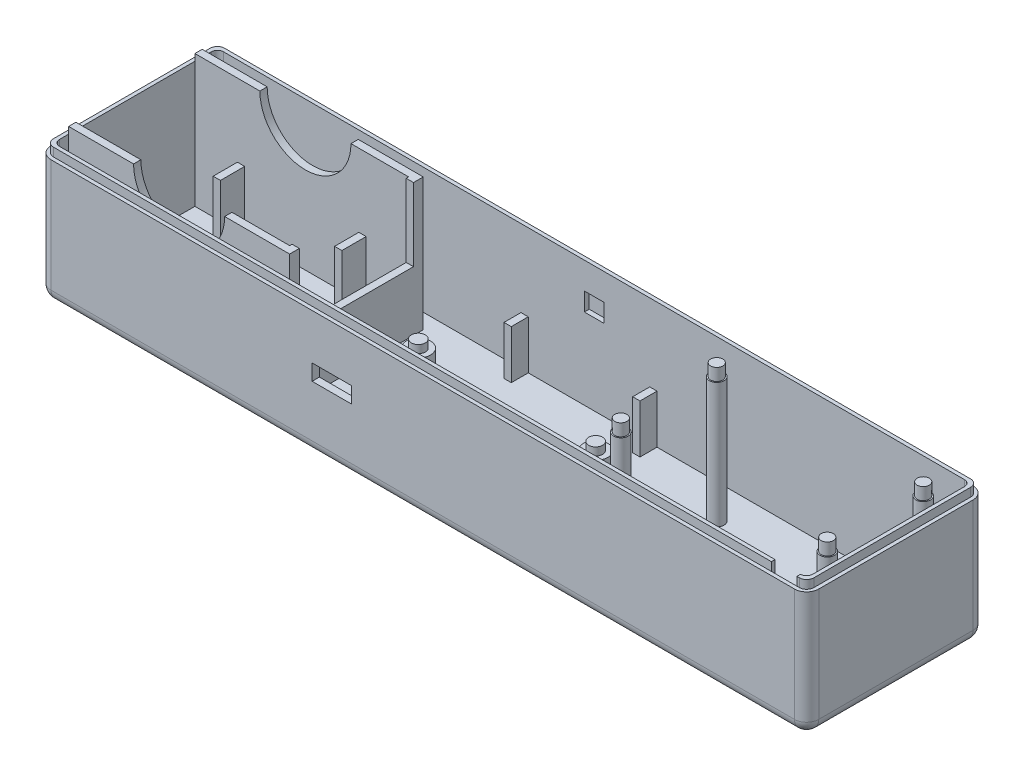
from build123d import *

# Parameters (mm, degrees)
SKETCH1_W            = 160.5788
SKETCH1_H            = 37.338
BOSS_EXTRUDE1_DEPTH  = 27.94
SKETCH2_W            = 157.5308
SKETCH2_H            = 34.29
CUT_EXTRUDE3_DEPTH   = 26.289
FILLET1_R            = 2.54
FILLET2_R            = 1.27
SKETCH3_W            = 46.228
SKETCH3_H            = 27.94
BOSS_EXTRUDE2_DEPTH  = 27.686
SKETCH8_W            = 44.704
SKETCH8_H            = 24.892
CUT_EXTRUDE6_DEPTH   = 27.686
CUT_EXTRUDE5_REACH   = 93.501
SKETCH7_R            = 9.525
CUT_EXTRUDE7_REACH   = 121.521
SKETCH9_W            = 23.876
SKETCH9_H            = 15.24
SKETCH10_R           = 2.54
SKETCH10_W           = 1.524
SKETCH10_H           = 3.556
BOSS_EXTRUDE5_DEPTH  = 10.16
SKETCH11_R           = 1.4605
BOSS_EXTRUDE6_DEPTH  = 1.651
CUT_EXTRUDE8_REACH   = 95.28
SKETCH12_W           = 8.218436834
SKETCH12_H           = 3.333271446
SKETCH13_R           = 1.524
BOSS_EXTRUDE7_DEPTH  = 26.162
SKETCH14_R           = 1.27
BOSS_EXTRUDE8_DEPTH  = 2.54
SKETCH15_W           = 1.524
SKETCH15_H           = 5.08
BOSS_EXTRUDE9_DEPTH  = 12.446
SKETCH16_OUTSIDE_W   = 196.104
SKETCH16_OUTSIDE_H   = 72.864
SKETCH16_OUTSIDE_W_2 = 159.0548
SKETCH16_OUTSIDE_H_2 = 35.814
CUT_EXTRUDE9_DEPTH   = 1.778
FILLET3_R            = 1.524
SKETCH17_W           = 5.334
SKETCH17_H           = 0.762
CUT_EXTRUDE10_DEPTH  = 8.89
SKETCH18_W           = 4.064
SKETCH18_H           = 3.81
CUT_EXTRUDE11_DEPTH  = 1.016
SKETCH19_W           = 0.284935898
SKETCH19_H           = 3.175
MAGNET_TEXT_DEPTH    = 0.1778


with BuildPart() as part:
    # Sketch1 → Boss-Extrude1 (new body)
    with BuildSketch(Plane(origin=(0, 0, 0), x_dir=(1, 0, 0), z_dir=(0, 1, 0))):
        Rectangle(SKETCH1_W, SKETCH1_H)
    extrude(amount=BOSS_EXTRUDE1_DEPTH)

    # Sketch2 → Cut-Extrude3 (cut)
    with BuildSketch(Plane(origin=(0, 27.94, 0), x_dir=(1, 0, 0), z_dir=(0, 1, 0))):
        Rectangle(SKETCH2_W, SKETCH2_H)
    extrude(amount=-CUT_EXTRUDE3_DEPTH, mode=Mode.SUBTRACT)

    # Fillet1
    fillet1_edges = [part.edges().sort_by_distance(p)[0] for p in [
        (0, 0, 18.669),
        (-80.2894, 0, 0),
        (0, 0, -18.669),
        (80.2894, 0, 0),
        (80.2894, 13.97, 18.669),
        (-80.2894, 13.97, 18.669),
        (-80.2894, 13.97, -18.669),
        (80.2894, 13.97, -18.669),
    ]]
    fillet(fillet1_edges, radius=FILLET1_R)

    # Fillet2
    fillet2_edges = [part.edges().sort_by_distance(p)[0] for p in [
        (-78.7654, 14.7955, -17.145),
        (-78.7654, 14.7955, 17.145),
        (78.7654, 14.7955, 17.145),
        (78.7654, 14.7955, -17.145),
    ]]
    fillet(fillet2_edges, radius=FILLET2_R)

    # Sketch3 → Boss-Extrude2 (add)
    with BuildSketch(Plane(origin=(0, 1.651, 0), x_dir=(1, 0, 0), z_dir=(0, 1, 0))):
        with Locations((-55.6514, 0)):
            Rectangle(SKETCH3_W, SKETCH3_H)
    extrude(amount=BOSS_EXTRUDE2_DEPTH)

    # Sketch8 → Cut-Extrude6 (cut)
    with BuildSketch(Plane(origin=(0, 29.337, 0), x_dir=(1, 0, 0), z_dir=(0, 1, 0))):
        with Locations((-56.4134, 0)):
            Rectangle(SKETCH8_W, SKETCH8_H)
    extrude(amount=-CUT_EXTRUDE6_DEPTH, mode=Mode.SUBTRACT)

    # Cut-Extrude5: up to this face of the body (flat: up to its plane)
    cut_extrude5_end = Plane(part.part.faces().sort_by_distance((-55.6514, 15.494, -13.97))[0])
    # Sketch7 → Cut-Extrude5 (cut, up to the picked face)
    with BuildSketch(Plane.XY.offset(13.97), mode=Mode.PRIVATE) as cut_extrude5_sk1:
        with Locations((-55.6514, 29.337)):
            Circle(SKETCH7_R)
    cut_extrude5_tool1 = split(extrude(cut_extrude5_sk1.sketch, amount=-CUT_EXTRUDE5_REACH, mode=Mode.PRIVATE), bisect_by=cut_extrude5_end, keep=Keep.BOTH, mode=Mode.PRIVATE)
    add(cut_extrude5_tool1.solids().sort_by(Axis((-55.6514, 29.337, 13.97), (0, 0, -1)))[0], mode=Mode.SUBTRACT)

    # Sketch9 → Cut-Extrude7 (cut, up to next)
    with BuildSketch(Plane.ZY.offset(34.0614), mode=Mode.PRIVATE) as cut_extrude7_sk1:
        with Locations((0, 21.717)):
            Rectangle(SKETCH9_W, SKETCH9_H)
    cut_extrude7_tool1 = extrude(cut_extrude7_sk1.sketch, amount=-CUT_EXTRUDE7_REACH, mode=Mode.PRIVATE) & part.part
    add(cut_extrude7_tool1.solids().sort_by_distance((-34.0614, 21.717, 0))[0], mode=Mode.SUBTRACT)

    # Sketch10 → Boss-Extrude5 (add)
    with BuildSketch(Plane(origin=(0, 1.651, 0), x_dir=(1, 0, 0), z_dir=(0, 1, 0))):
        with Locations(Location((-19.5834, 0, 0), (0, 0, 90))):
            Circle(SKETCH10_R)
        with Locations(Location((17.5006, 0, 0), (0, 0, 90))):
            Circle(SKETCH10_R)
        with Locations((-14.5034, 15.367)):
            Rectangle(SKETCH10_W, SKETCH10_H)
        with Locations((12.4206, 15.367)):
            Rectangle(SKETCH10_W, SKETCH10_H)
        with Locations((-14.5034, -15.367)):
            Rectangle(SKETCH10_W, SKETCH10_H)
        with Locations((12.4206, -15.367)):
            Rectangle(SKETCH10_W, SKETCH10_H)
    extrude(amount=BOSS_EXTRUDE5_DEPTH)

    # Sketch11 → Boss-Extrude6 (add)
    with BuildSketch(Plane(origin=(0, 11.811, 0), x_dir=(1, 0, 0), z_dir=(0, 1, 0))):
        with Locations(Location((17.5006, 0, 0), (0, 0, 90))):
            Circle(SKETCH11_R)
        with Locations(Location((-19.5834, 0, 0), (0, 0, 90))):
            Circle(SKETCH11_R)
    extrude(amount=BOSS_EXTRUDE6_DEPTH)

    # Sketch12 → Cut-Extrude8 (cut, up to next)
    with BuildSketch(Plane.XY.offset(18.669), mode=Mode.PRIVATE) as cut_extrude8_sk1:
        with Locations((-19.030181583, 15.001635723)):
            Rectangle(SKETCH12_W, SKETCH12_H)
    cut_extrude8_tool1 = extrude(cut_extrude8_sk1.sketch, amount=-CUT_EXTRUDE8_REACH, mode=Mode.PRIVATE) & part.part
    add(cut_extrude8_tool1.solids().sort_by_distance((-19.030182, 15.001636, 18.669))[0], mode=Mode.SUBTRACT)

    # Sketch13 → Boss-Extrude7 (add)
    with BuildSketch(Plane(origin=(0, 1.651, 0), x_dir=(1, 0, 0), z_dir=(0, 1, 0))):
        with Locations(Location((32.7914, 10.033, 0), (0, 0, 90))):
            Circle(SKETCH13_R)
        with Locations(Location((75.9714, 10.033, 0), (0, 0, 90))):
            Circle(SKETCH13_R)
        with Locations(Location((75.9714, -10.033, 0), (0, 0, 90))):
            Circle(SKETCH13_R)
        with Locations(Location((32.7914, -10.033, 0), (0, 0, 90))):
            Circle(SKETCH13_R)
    extrude(amount=BOSS_EXTRUDE7_DEPTH)

    # Sketch14 → Boss-Extrude8 (add)
    with BuildSketch(Plane(origin=(0, 27.813, 0), x_dir=(1, 0, 0), z_dir=(0, 1, 0))):
        with Locations(Location((32.7914, 10.033, 0), (0, 0, 270))):
            Circle(SKETCH14_R)
        with Locations(Location((32.7914, -10.033, 0), (0, 0, 270))):
            Circle(SKETCH14_R)
        with Locations(Location((75.9714, -10.033, 0), (0, 0, 270))):
            Circle(SKETCH14_R)
        with Locations(Location((75.9714, 10.033, 0), (0, 0, 270))):
            Circle(SKETCH14_R)
    extrude(amount=BOSS_EXTRUDE8_DEPTH)

    # Sketch15 → Boss-Extrude9 (add)
    with BuildSketch(Plane(origin=(0, 1.651, 0), x_dir=(1, 0, 0), z_dir=(0, 1, 0))):
        with Locations((-43.7134, 9.906)):
            Rectangle(SKETCH15_W, SKETCH15_H)
        with Locations((-43.7134, -9.906)):
            Rectangle(SKETCH15_W, SKETCH15_H)
        with Locations((-69.1134, 9.906)):
            Rectangle(SKETCH15_W, SKETCH15_H)
        with Locations((-69.1134, -9.906)):
            Rectangle(SKETCH15_W, SKETCH15_H)
    extrude(amount=BOSS_EXTRUDE9_DEPTH)

    # Sketch16 outside → Cut-Extrude9 (cut)
    with BuildSketch(Plane(origin=(0, 27.94, 0), x_dir=(1, 0, 0), z_dir=(0, 1, 0))):
        Rectangle(SKETCH16_OUTSIDE_W, SKETCH16_OUTSIDE_H)
        Rectangle(SKETCH16_OUTSIDE_W_2, SKETCH16_OUTSIDE_H_2, mode=Mode.SUBTRACT)
    extrude(amount=-CUT_EXTRUDE9_DEPTH, mode=Mode.SUBTRACT)

    # Fillet3
    fillet3_edges = [part.edges().sort_by_distance(p)[0] for p in [
        (-79.5274, 27.051, -17.907),
        (79.5274, 27.051, -17.907),
        (79.5274, 27.051, 17.907),
        (-79.5274, 27.051, 17.907),
    ]]
    fillet(fillet3_edges, radius=FILLET3_R)

    # Sketch17 → Cut-Extrude10 (cut)
    with BuildSketch(Plane(origin=(0, 27.94, 0), x_dir=(1, 0, 0), z_dir=(0, 1, 0))):
        with Locations((74.8284, -17.526)):
            Rectangle(SKETCH17_W, SKETCH17_H)
    extrude(amount=-CUT_EXTRUDE10_DEPTH, mode=Mode.SUBTRACT)

    # Sketch18 → Cut-Extrude11 (cut)
    with BuildSketch(Plane(origin=(0, 0, 17.145), x_dir=(-1, 0, 0), z_dir=(0, 0, -1))):
        with Locations((-0.0254, 20.447)):
            Rectangle(SKETCH18_W, SKETCH18_H)
    cut_extrude11 = extrude(amount=-CUT_EXTRUDE11_DEPTH, mode=Mode.SUBTRACT)

    # Mirror1: Cut-Extrude11 across plane
    add(cut_extrude11.mirror(Plane.XY), mode=Mode.SUBTRACT)

    # Sketch19 → Magnet Text (cut)
    # profile 1 of 16: a face of its own
    with BuildSketch(Plane(origin=(0, 0, -18.669), x_dir=(-1, 0, 0), z_dir=(0, 0, -1))):
        Polygon((-14.778698451, 19.911562535), (-14.778698451, 20.237203561), (-13.109788194, 20.237203561), (-13.109788194, 19.911562535), (-13.801775374, 19.911562535), (-13.801775374, 17.062203561), (-14.086711271, 17.062203561), (-14.086711271, 19.911562535), align=None)
    # profile 2 of 16: a face of its own
    with BuildSketch(Plane(origin=(0, 0, -18.669), x_dir=(-1, 0, 0), z_dir=(0, 0, -1))):
        Polygon((-12.621326656, 20.237203561), (-12.336390758, 20.237203561), (-12.336390758, 18.934639459), (-10.70818563, 18.934639459), (-10.70818563, 20.237203561), (-10.423249733, 20.237203561), (-10.423249733, 17.062203561), (-10.70818563, 17.062203561), (-10.70818563, 18.608998433), (-12.336390758, 18.608998433), (-12.336390758, 17.062203561), (-12.621326656, 17.062203561), align=None)
    # profile 3 of 16: a face of its own
    with BuildSketch(Plane(origin=(0, 0, -18.669), x_dir=(-1, 0, 0), z_dir=(0, 0, -1))):
        with Locations((-9.46667922, 18.649703561)):
            Rectangle(SKETCH19_W, SKETCH19_H)
    # profile 4 of 16: a face of its own
    with BuildSketch(Plane(origin=(0, 0, -18.669), x_dir=(-1, 0, 0), z_dir=(0, 0, -1))):
        with BuildLine():
            Line((-8.835749733, 17.674688537), (-8.567350294, 17.835600997))
            add(Edge.make_bspline(
                [(-8.567350294, 17.835600997), (-8.542387321, 17.793814019), (-8.494559229, 17.713751782), (-8.414774782, 17.605567703), (-8.332104213, 17.513617746), (-8.245935317, 17.438436824), (-8.156794064, 17.379246762), (-8.06409853, 17.337334738), (-7.968161087, 17.311194532), (-7.902870549, 17.308019453), (-7.870274973, 17.30643433)],
                knots=[0, 0, 0, 0, 1.272034388, 2.437168799, 3.508375237, 4.49857839, 5.41946034, 6.295179144, 7.148887113, 8, 8, 8, 8], degree=3))
            add(Edge.make_bspline(
                [(-7.870274973, 17.30643433), (-7.842437607, 17.30720964), (-7.787249963, 17.308746694), (-7.706004214, 17.323515708), (-7.627099293, 17.346205282), (-7.552161457, 17.378699984), (-7.482224721, 17.418014182), (-7.420895791, 17.465499643), (-7.367876816, 17.518663844), (-7.32450712, 17.577975252), (-7.291233088, 17.641762951), (-7.265658854, 17.70723685), (-7.251466537, 17.775425479), (-7.249328625, 17.821336399), (-7.248249733, 17.844505244)],
                knots=[0, 0, 0, 0, 1.095163259, 2.171163733, 3.241058638, 4.321873601, 5.38011039, 6.391990106, 7.366004449, 8.327778327, 9.272591725, 10.192022065, 11.087607919, 12, 12, 12, 12], degree=3))
            add(Edge.make_bspline(
                [(-7.248249733, 17.844505244), (-7.249587143, 17.870940157), (-7.252305903, 17.924678474), (-7.275285174, 18.003962445), (-7.311434134, 18.082423562), (-7.344783103, 18.130956853), (-7.362096888, 18.156153882)],
                knots=[0, 0, 0, 0, 0.938893495, 1.908633276, 2.914225137, 4, 4, 4, 4], degree=3))
            add(Edge.make_bspline(
                [(-7.362096888, 18.156153882), (-7.376312374, 18.174339214), (-7.406156008, 18.212517046), (-7.457461751, 18.269345224), (-7.517665298, 18.327963361), (-7.58470638, 18.390609791), (-7.661027111, 18.454370864), (-7.74423707, 18.522287088), (-7.836460714, 18.591775661), (-7.901139543, 18.638377917), (-7.934512753, 18.662423914)],
                knots=[0, 0, 0, 0, 0.722233717, 1.516239348, 2.393582979, 3.351407094, 4.387010283, 5.505090956, 6.712668013, 8, 8, 8, 8], degree=3))
            add(Edge.make_bspline(
                [(-7.934512753, 18.662423914), (-7.967917379, 18.68621699), (-8.031784478, 18.731707539), (-8.121100478, 18.799220997), (-8.200969383, 18.860946507), (-8.271036206, 18.917465146), (-8.331270126, 18.968784581), (-8.382145791, 19.014411997), (-8.422367197, 19.05558137), (-8.444733331, 19.082288873), (-8.454775173, 19.094279883)],
                knots=[0, 0, 0, 0, 1.452282411, 2.77665338, 3.964542531, 5.026858415, 5.96415736, 6.766646006, 7.446254459, 8, 8, 8, 8], degree=3))
            add(Edge.make_bspline(
                [(-8.454775173, 19.094279883), (-8.468810982, 19.112967967), (-8.496414284, 19.149720591), (-8.532850589, 19.207165283), (-8.563819687, 19.265969245), (-8.588096945, 19.326290494), (-8.608540515, 19.387282179), (-8.622290924, 19.449740095), (-8.630900977, 19.513383985), (-8.631782707, 19.556213375), (-8.632224092, 19.577653281)],
                knots=[0, 0, 0, 0, 1.068054152, 2.10047183, 3.106115577, 4.101338837, 5.06977816, 6.043150881, 7.020423561, 8, 8, 8, 8], degree=3))
            add(Edge.make_bspline(
                [(-8.632224092, 19.577653281), (-8.631040081, 19.611244576), (-8.628697366, 19.677709177), (-8.608884897, 19.77480143), (-8.577613057, 19.867499109), (-8.533802695, 19.954884483), (-8.477326382, 20.034682194), (-8.411970391, 20.107810143), (-8.334127114, 20.169285928), (-8.248717234, 20.222999724), (-8.155230383, 20.265042099), (-8.057267206, 20.296756703), (-7.954672005, 20.314726529), (-7.885182018, 20.317305323), (-7.849922409, 20.318613818)],
                knots=[0, 0, 0, 0, 1.005424448, 1.989358655, 2.955360095, 3.929531133, 4.905563448, 5.876582895, 6.856512386, 7.866279853, 8.892233794, 9.918561126, 10.94386622, 12, 12, 12, 12], degree=3))
            add(Edge.make_bspline(
                [(-7.849922409, 20.318613818), (-7.812508118, 20.31732336), (-7.738103035, 20.314757052), (-7.62865696, 20.292443577), (-7.523282596, 20.255522253), (-7.438516206, 20.213622542), (-7.372174344, 20.171774758), (-7.321580508, 20.133656774), (-7.270311106, 20.08977364), (-7.217952585, 20.040008467), (-7.165392129, 19.983904629), (-7.111849426, 19.921846361), (-7.057199268, 19.854212914), (-7.022042167, 19.805930688), (-7.004018963, 19.781178922)],
                knots=[0, 0, 0, 0, 1.286793592, 2.559021753, 3.825965368, 5.121522368, 5.803751409, 6.523245864, 7.299691795, 8.125521123, 9.008227632, 9.944561021, 10.946284179, 12, 12, 12, 12], degree=3))
            Line((-7.004018963, 19.781178922), (-7.261606103, 19.58592151))
            add(Edge.make_bspline(
                [(-7.261606103, 19.58592151), (-7.277159913, 19.605959108), (-7.307112915, 19.644546836), (-7.352587521, 19.698586529), (-7.395448794, 19.74795005), (-7.437676657, 19.790826273), (-7.47704088, 19.829563209), (-7.515247054, 19.862728131), (-7.551745358, 19.890645992), (-7.597752841, 19.920439793), (-7.655553914, 19.949973193), (-7.728111315, 19.974964142), (-7.803936007, 19.989981948), (-7.855579316, 19.991967582), (-7.88172329, 19.992972792)],
                knots=[0, 0, 0, 0, 1.181633172, 2.275549214, 3.290209073, 4.226197932, 5.078386478, 5.862611352, 6.581680152, 7.217281963, 8.414376989, 9.595101626, 10.782541182, 12, 12, 12, 12], degree=3))
            add(Edge.make_bspline(
                [(-7.88172329, 19.992972792), (-7.914522421, 19.991873607), (-7.977772456, 19.989753932), (-8.067570741, 19.96660366), (-8.148391659, 19.930152972), (-8.217835772, 19.879067242), (-8.275654315, 19.81854177), (-8.317478553, 19.74889238), (-8.342651916, 19.671982629), (-8.345723756, 19.618332698), (-8.347288194, 19.591009651)],
                knots=[0, 0, 0, 0, 1.14458467, 2.207223713, 3.21896685, 4.227309161, 5.202851033, 6.127160689, 7.046193047, 8, 8, 8, 8], degree=3))
            add(Edge.make_bspline(
                [(-8.347288194, 19.591009651), (-8.346931572, 19.573999381), (-8.346217745, 19.539951026), (-8.336262036, 19.489648665), (-8.32347193, 19.439473378), (-8.303203971, 19.38965075), (-8.275222874, 19.339309438), (-8.238478893, 19.287582576), (-8.192202532, 19.234014241), (-8.156754099, 19.199173266), (-8.138038394, 19.180778281)],
                knots=[0, 0, 0, 0, 0.858281714, 1.717966888, 2.583508476, 3.4729293, 4.427298488, 5.488583878, 6.674047936, 8, 8, 8, 8], degree=3))
            add(Edge.make_bspline(
                [(-8.138038394, 19.180778281), (-8.131088435, 19.174576122), (-8.114576923, 19.159841211), (-8.084390905, 19.135718214), (-8.044528509, 19.105961413), (-7.996030655, 19.069142919), (-7.93800312, 19.026433307), (-7.870439522, 18.978378673), (-7.794092989, 18.923419007), (-7.73991668, 18.884994666), (-7.711270566, 18.864677519)],
                knots=[0, 0, 0, 0, 0.420754252, 0.999615792, 1.744751191, 2.668019286, 3.750313428, 4.999500688, 6.413464383, 8, 8, 8, 8], degree=3))
            add(Edge.make_bspline(
                [(-7.711270566, 18.864677519), (-7.676811916, 18.839602858), (-7.610087516, 18.79104925), (-7.51514814, 18.71810074), (-7.4290659, 18.646755979), (-7.351538565, 18.577470578), (-7.281800227, 18.510770094), (-7.22062458, 18.445852066), (-7.167388285, 18.383181582), (-7.110075708, 18.302833603), (-7.051512543, 18.204153619), (-7.001219176, 18.083251217), (-6.96950696, 17.961878841), (-6.965359943, 17.880302353), (-6.963313835, 17.84005312)],
                knots=[0, 0, 0, 0, 1.163667725, 2.253281268, 3.268753668, 4.215851969, 5.092017293, 5.902905408, 6.650798638, 7.335211899, 8.59617414, 9.77448103, 10.901945474, 12, 12, 12, 12], degree=3))
            add(Edge.make_bspline(
                [(-6.963313835, 17.84005312), (-6.963909953, 17.811588461), (-6.965090613, 17.755211906), (-6.9786623, 17.672430514), (-6.998546567, 17.592029654), (-7.028516058, 17.515003145), (-7.065094923, 17.439941824), (-7.111510019, 17.368814658), (-7.165310562, 17.300047425), (-7.227026906, 17.235473829), (-7.294559974, 17.176195494), (-7.365937326, 17.123464131), (-7.441275788, 17.079496438), (-7.520166661, 17.043618174), (-7.602628066, 17.015557054), (-7.68863227, 16.99522538), (-7.778321041, 16.982746985), (-7.839281478, 16.981451802), (-7.870274973, 16.980793305)],
                knots=[0, 0, 0, 0, 0.983748083, 1.948392443, 2.894712957, 3.844097841, 4.80183111, 5.778335162, 6.776009319, 7.81870978, 8.863265674, 9.881300176, 10.883814829, 11.87499822, 12.874611388, 13.892143829, 14.928324115, 16, 16, 16, 16], degree=3))
            add(Edge.make_bspline(
                [(-7.870274973, 16.980793305), (-7.894255606, 16.981257019), (-7.941914859, 16.982178609), (-8.012408461, 16.990325913), (-8.081477945, 17.001853072), (-8.148256615, 17.020153835), (-8.213604839, 17.04235795), (-8.277238402, 17.069697723), (-8.339188143, 17.102461184), (-8.399801236, 17.139921671), (-8.458923523, 17.183516911), (-8.516000469, 17.234292868), (-8.572904802, 17.290849148), (-8.62795694, 17.354721587), (-8.682270435, 17.424878277), (-8.734774421, 17.501975607), (-8.786555693, 17.585593635), (-8.819045439, 17.644435535), (-8.835749733, 17.674688537)],
                knots=[0, 0, 0, 0, 0.915332311, 1.819136955, 2.706846663, 3.586547465, 4.459518054, 5.340707479, 6.227863349, 7.133153174, 8.059268498, 9.028702269, 10.047606654, 11.120612155, 12.245963614, 13.433783089, 14.680604001, 16, 16, 16, 16], degree=3))
        make_face()
    # profile 5 of 16: a face of its own
    with BuildSketch(Plane(origin=(0, 0, -18.669), x_dir=(-1, 0, 0), z_dir=(0, 0, -1))):
        with BuildLine():
            Line((-5.416518963, 17.674688537), (-5.148119524, 17.835600997))
            add(Edge.make_bspline(
                [(-5.148119524, 17.835600997), (-5.123156552, 17.793814019), (-5.07532846, 17.713751782), (-4.995544013, 17.605567703), (-4.912873444, 17.513617746), (-4.826704548, 17.438436824), (-4.737563295, 17.379246762), (-4.644867761, 17.337334738), (-4.548930318, 17.311194532), (-4.48363978, 17.308019453), (-4.451044204, 17.30643433)],
                knots=[0, 0, 0, 0, 1.272034388, 2.437168799, 3.508375237, 4.49857839, 5.41946034, 6.295179144, 7.148887113, 8, 8, 8, 8], degree=3))
            add(Edge.make_bspline(
                [(-4.451044204, 17.30643433), (-4.423206837, 17.30720964), (-4.368019193, 17.308746694), (-4.286773444, 17.323515708), (-4.207868524, 17.346205282), (-4.132930688, 17.378699984), (-4.062993952, 17.418014182), (-4.001665021, 17.465499643), (-3.948646047, 17.518663844), (-3.90527635, 17.577975252), (-3.872002318, 17.641762951), (-3.846428085, 17.70723685), (-3.832235768, 17.775425479), (-3.830097856, 17.821336399), (-3.829018963, 17.844505244)],
                knots=[0, 0, 0, 0, 1.095163259, 2.171163733, 3.241058638, 4.321873601, 5.38011039, 6.391990106, 7.366004449, 8.327778327, 9.272591725, 10.192022065, 11.087607919, 12, 12, 12, 12], degree=3))
            add(Edge.make_bspline(
                [(-3.829018963, 17.844505244), (-3.830356374, 17.870940157), (-3.833075134, 17.924678474), (-3.856054405, 18.003962445), (-3.892203365, 18.082423562), (-3.925552334, 18.130956853), (-3.942866119, 18.156153882)],
                knots=[0, 0, 0, 0, 0.938893495, 1.908633276, 2.914225137, 4, 4, 4, 4], degree=3))
            add(Edge.make_bspline(
                [(-3.942866119, 18.156153882), (-3.957081605, 18.174339214), (-3.986925239, 18.212517046), (-4.038230982, 18.269345224), (-4.098434529, 18.327963361), (-4.165475611, 18.390609791), (-4.241796341, 18.454370864), (-4.325006301, 18.522287088), (-4.417229944, 18.591775661), (-4.481908773, 18.638377917), (-4.515281984, 18.662423914)],
                knots=[0, 0, 0, 0, 0.722233717, 1.516239348, 2.393582979, 3.351407094, 4.387010283, 5.505090956, 6.712668013, 8, 8, 8, 8], degree=3))
            add(Edge.make_bspline(
                [(-4.515281984, 18.662423914), (-4.548686609, 18.68621699), (-4.612553709, 18.731707539), (-4.701869709, 18.799220997), (-4.781738614, 18.860946507), (-4.851805436, 18.917465146), (-4.912039356, 18.968784581), (-4.962915022, 19.014411997), (-5.003136427, 19.05558137), (-5.025502561, 19.082288873), (-5.035544404, 19.094279883)],
                knots=[0, 0, 0, 0, 1.452282411, 2.77665338, 3.964542531, 5.026858415, 5.96415736, 6.766646006, 7.446254459, 8, 8, 8, 8], degree=3))
            add(Edge.make_bspline(
                [(-5.035544404, 19.094279883), (-5.049580213, 19.112967967), (-5.077183515, 19.149720591), (-5.11361982, 19.207165283), (-5.144588918, 19.265969245), (-5.168866176, 19.326290494), (-5.189309746, 19.387282179), (-5.203060154, 19.449740095), (-5.211670207, 19.513383985), (-5.212551938, 19.556213375), (-5.212993322, 19.577653281)],
                knots=[0, 0, 0, 0, 1.068054152, 2.10047183, 3.106115577, 4.101338837, 5.06977816, 6.043150881, 7.020423561, 8, 8, 8, 8], degree=3))
            add(Edge.make_bspline(
                [(-5.212993322, 19.577653281), (-5.211809311, 19.611244576), (-5.209466597, 19.677709177), (-5.189654127, 19.77480143), (-5.158382288, 19.867499109), (-5.114571926, 19.954884483), (-5.058095613, 20.034682194), (-4.992739622, 20.107810143), (-4.914896345, 20.169285928), (-4.829486465, 20.222999724), (-4.735999613, 20.265042099), (-4.638036437, 20.296756703), (-4.535441236, 20.314726529), (-4.465951249, 20.317305323), (-4.43069164, 20.318613818)],
                knots=[0, 0, 0, 0, 1.005424448, 1.989358655, 2.955360095, 3.929531133, 4.905563448, 5.876582895, 6.856512386, 7.866279853, 8.892233794, 9.918561126, 10.94386622, 12, 12, 12, 12], degree=3))
            add(Edge.make_bspline(
                [(-4.43069164, 20.318613818), (-4.393277349, 20.31732336), (-4.318872265, 20.314757052), (-4.209426191, 20.292443577), (-4.104051827, 20.255522253), (-4.019285437, 20.213622542), (-3.952943575, 20.171774758), (-3.902349739, 20.133656774), (-3.851080337, 20.08977364), (-3.798721816, 20.040008467), (-3.74616136, 19.983904629), (-3.692618657, 19.921846361), (-3.637968499, 19.854212914), (-3.602811397, 19.805930688), (-3.584788194, 19.781178922)],
                knots=[0, 0, 0, 0, 1.286793592, 2.559021753, 3.825965368, 5.121522368, 5.803751409, 6.523245864, 7.299691795, 8.125521123, 9.008227632, 9.944561021, 10.946284179, 12, 12, 12, 12], degree=3))
            Line((-3.584788194, 19.781178922), (-3.842375334, 19.58592151))
            add(Edge.make_bspline(
                [(-3.842375334, 19.58592151), (-3.857929144, 19.605959108), (-3.887882146, 19.644546836), (-3.933356751, 19.698586529), (-3.976218025, 19.74795005), (-4.018445888, 19.790826273), (-4.05781011, 19.829563209), (-4.096016284, 19.862728131), (-4.132514589, 19.890645992), (-4.178522072, 19.920439793), (-4.236323145, 19.949973193), (-4.308880546, 19.974964142), (-4.384705238, 19.989981948), (-4.436348547, 19.991967582), (-4.462492521, 19.992972792)],
                knots=[0, 0, 0, 0, 1.181633172, 2.275549214, 3.290209073, 4.226197932, 5.078386478, 5.862611352, 6.581680152, 7.217281963, 8.414376989, 9.595101626, 10.782541182, 12, 12, 12, 12], degree=3))
            add(Edge.make_bspline(
                [(-4.462492521, 19.992972792), (-4.495291652, 19.991873607), (-4.558541687, 19.989753932), (-4.648339972, 19.96660366), (-4.72916089, 19.930152972), (-4.798605003, 19.879067242), (-4.856423546, 19.81854177), (-4.898247784, 19.74889238), (-4.923421147, 19.671982629), (-4.926492987, 19.618332698), (-4.928057425, 19.591009651)],
                knots=[0, 0, 0, 0, 1.14458467, 2.207223713, 3.21896685, 4.227309161, 5.202851033, 6.127160689, 7.046193047, 8, 8, 8, 8], degree=3))
            add(Edge.make_bspline(
                [(-4.928057425, 19.591009651), (-4.927700803, 19.573999381), (-4.926986976, 19.539951026), (-4.917031266, 19.489648665), (-4.904241161, 19.439473378), (-4.883973202, 19.38965075), (-4.855992105, 19.339309438), (-4.819248124, 19.287582576), (-4.772971763, 19.234014241), (-4.73752333, 19.199173266), (-4.718807625, 19.180778281)],
                knots=[0, 0, 0, 0, 0.858281714, 1.717966888, 2.583508476, 3.4729293, 4.427298488, 5.488583878, 6.674047936, 8, 8, 8, 8], degree=3))
            add(Edge.make_bspline(
                [(-4.718807625, 19.180778281), (-4.711857666, 19.174576122), (-4.695346154, 19.159841211), (-4.665160135, 19.135718214), (-4.62529774, 19.105961413), (-4.576799886, 19.069142919), (-4.518772351, 19.026433307), (-4.451208753, 18.978378673), (-4.37486222, 18.923419007), (-4.32068591, 18.884994666), (-4.292039797, 18.864677519)],
                knots=[0, 0, 0, 0, 0.420754252, 0.999615792, 1.744751191, 2.668019286, 3.750313428, 4.999500688, 6.413464383, 8, 8, 8, 8], degree=3))
            add(Edge.make_bspline(
                [(-4.292039797, 18.864677519), (-4.257581147, 18.839602858), (-4.190856747, 18.79104925), (-4.095917371, 18.71810074), (-4.009835131, 18.646755979), (-3.932307796, 18.577470578), (-3.862569458, 18.510770094), (-3.801393811, 18.445852066), (-3.748157515, 18.383181582), (-3.690844939, 18.302833603), (-3.632281774, 18.204153619), (-3.581988406, 18.083251217), (-3.550276191, 17.961878841), (-3.546129174, 17.880302353), (-3.544083066, 17.84005312)],
                knots=[0, 0, 0, 0, 1.163667725, 2.253281268, 3.268753668, 4.215851969, 5.092017293, 5.902905408, 6.650798638, 7.335211899, 8.59617414, 9.77448103, 10.901945474, 12, 12, 12, 12], degree=3))
            add(Edge.make_bspline(
                [(-3.544083066, 17.84005312), (-3.544679184, 17.811588461), (-3.545859844, 17.755211906), (-3.55943153, 17.672430514), (-3.579315798, 17.592029654), (-3.609285289, 17.515003145), (-3.645864154, 17.439941824), (-3.69227925, 17.368814658), (-3.746079793, 17.300047425), (-3.807796137, 17.235473829), (-3.875329205, 17.176195494), (-3.946706557, 17.123464131), (-4.022045018, 17.079496438), (-4.100935891, 17.043618174), (-4.183397297, 17.015557054), (-4.269401501, 16.99522538), (-4.359090272, 16.982746985), (-4.420050709, 16.981451802), (-4.451044204, 16.980793305)],
                knots=[0, 0, 0, 0, 0.983748083, 1.948392443, 2.894712957, 3.844097841, 4.80183111, 5.778335162, 6.776009319, 7.81870978, 8.863265674, 9.881300176, 10.883814829, 11.87499822, 12.874611388, 13.892143829, 14.928324115, 16, 16, 16, 16], degree=3))
            add(Edge.make_bspline(
                [(-4.451044204, 16.980793305), (-4.475024836, 16.981257019), (-4.52268409, 16.982178609), (-4.593177692, 16.990325913), (-4.662247176, 17.001853072), (-4.729025846, 17.020153835), (-4.79437407, 17.04235795), (-4.858007632, 17.069697723), (-4.919957374, 17.102461184), (-4.980570467, 17.139921671), (-5.039692754, 17.183516911), (-5.0967697, 17.234292868), (-5.153674032, 17.290849148), (-5.208726171, 17.354721587), (-5.263039666, 17.424878277), (-5.315543652, 17.501975607), (-5.367324924, 17.585593635), (-5.39981467, 17.644435535), (-5.416518963, 17.674688537)],
                knots=[0, 0, 0, 0, 0.915332311, 1.819136955, 2.706846663, 3.586547465, 4.459518054, 5.340707479, 6.227863349, 7.133153174, 8.059268498, 9.028702269, 10.047606654, 11.120612155, 12.245963614, 13.433783089, 14.680604001, 16, 16, 16, 16], degree=3))
        make_face()
    # profile 6 of 16: a face of its own
    with BuildSketch(Plane(origin=(0, 0, -18.669), x_dir=(-1, 0, 0), z_dir=(0, 0, -1))):
        with Locations((-2.750333066, 18.649703561)):
            Rectangle(SKETCH19_W, SKETCH19_H)
    # profile 7 of 16: a face of its own
    with BuildSketch(Plane(origin=(0, 0, -18.669), x_dir=(-1, 0, 0), z_dir=(0, 0, -1))):
        with BuildLine():
            Line((-1.793762553, 17.062203561), (-1.793762553, 20.237203561))
            Line((-1.793762553, 20.237203561), (-1.152656784, 20.237203561))
            add(Edge.make_bspline(
                [(-1.152656784, 20.237203561), (-1.09689563, 20.236802087), (-0.989165372, 20.236026441), (-0.833488366, 20.231108465), (-0.68944881, 20.222408542), (-0.557520431, 20.209736186), (-0.437341045, 20.194175934), (-0.329247165, 20.174671996), (-0.232679864, 20.151641299), (-0.173289729, 20.132005783), (-0.145204861, 20.122720388)],
                knots=[0, 0, 0, 0, 1.314313732, 2.53924729, 3.670748893, 4.714932338, 5.66265055, 6.526160246, 7.303039223, 8, 8, 8, 8], degree=3))
            add(Edge.make_bspline(
                [(-0.145204861, 20.122720388), (-0.108470347, 20.108722534), (-0.035834337, 20.08104425), (0.06758641, 20.028832462), (0.164945846, 19.969674863), (0.25676607, 19.903493473), (0.340949677, 19.828414385), (0.420785412, 19.747626886), (0.49300734, 19.658193178), (0.55914558, 19.56196801), (0.618777214, 19.460084934), (0.670610593, 19.352738085), (0.713658144, 19.240472618), (0.749393428, 19.123600734), (0.777557, 19.001865448), (0.796772038, 18.875125013), (0.809445722, 18.743880319), (0.810719397, 18.654822056), (0.811365652, 18.609634451)],
                knots=[0, 0, 0, 0, 0.984719456, 1.947108742, 2.898477687, 3.838006223, 4.779231079, 5.722358779, 6.681677486, 7.655904652, 8.64651281, 9.637519902, 10.640069247, 11.656948941, 12.698408672, 13.768548281, 14.867775369, 16, 16, 16, 16], degree=3))
            add(Edge.make_bspline(
                [(0.811365652, 18.609634451), (0.810795089, 18.570390327), (0.809670734, 18.493055683), (0.799574855, 18.379081442), (0.784900621, 18.268488416), (0.762181956, 18.161803246), (0.734602533, 18.058091219), (0.699256482, 17.958457683), (0.65876571, 17.861988656), (0.611549035, 17.769988518), (0.559713635, 17.682827173), (0.504086054, 17.600662229), (0.444725623, 17.524666135), (0.381066299, 17.454608751), (0.313930728, 17.390595691), (0.242879371, 17.33209222), (0.167728889, 17.280243059), (0.088815876, 17.233010754), (0.003838245, 17.191808003), (-0.088813577, 17.156946494), (-0.189534717, 17.128057065), (-0.298077949, 17.103953466), (-0.414630818, 17.084833342), (-0.539307594, 17.072018686), (-0.671916721, 17.063352811), (-0.762975055, 17.062594083), (-0.809843282, 17.062203561)],
                knots=[0, 0, 0, 0, 1.105936401, 2.179363191, 3.223086493, 4.248585256, 5.251745608, 6.245858792, 7.225916811, 8.198733463, 9.158002045, 10.082870192, 10.993790845, 11.873723703, 12.748670949, 13.606408763, 14.465103618, 15.319838547, 16.196477973, 17.123216899, 18.106603292, 19.147568657, 20.255746949, 21.433717677, 22.679120308, 24, 24, 24, 24], degree=3))
            Line((-0.809843282, 17.062203561), (-1.793762553, 17.062203561))
        make_face()
        with BuildLine():
            Line((-1.508826656, 17.387844587), (-1.144388555, 17.387844587))
            add(Edge.make_bspline(
                [(-1.144388555, 17.387844587), (-1.092020676, 17.388069646), (-0.991298066, 17.388502516), (-0.846465454, 17.392300908), (-0.714132001, 17.398507522), (-0.594278918, 17.407193486), (-0.486973874, 17.41868573), (-0.391992615, 17.431499034), (-0.309646488, 17.447462436), (-0.259817642, 17.461932235), (-0.236791399, 17.468618826)],
                knots=[0, 0, 0, 0, 1.375205317, 2.645023457, 3.804390687, 4.853969522, 5.800190428, 6.637939096, 7.370582563, 8, 8, 8, 8], degree=3))
            add(Edge.make_bspline(
                [(-0.236791399, 17.468618826), (-0.207809671, 17.478825596), (-0.150538442, 17.498995349), (-0.068096315, 17.535786942), (0.008790397, 17.579367962), (0.081461634, 17.627811454), (0.148886529, 17.682826041), (0.21186412, 17.743215438), (0.270267611, 17.809286984), (0.32349359, 17.880958673), (0.371126123, 17.957784417), (0.412375024, 18.03900893), (0.448526057, 18.123742251), (0.476900208, 18.213285559), (0.499139345, 18.306838348), (0.514891598, 18.404407198), (0.524702098, 18.50597389), (0.525846412, 18.575054745), (0.526429755, 18.610270468)],
                knots=[0, 0, 0, 0, 0.998632004, 1.973411704, 2.929992603, 3.868527914, 4.809262121, 5.754881198, 6.702106254, 7.672490631, 8.653608572, 9.636854334, 10.631411391, 11.644891563, 12.686317036, 13.754757253, 14.855430412, 16, 16, 16, 16], degree=3))
            add(Edge.make_bspline(
                [(0.526429755, 18.610270468), (0.52596413, 18.647402982), (0.525049405, 18.720350135), (0.513551995, 18.827384552), (0.496750298, 18.930327713), (0.472453669, 19.029186505), (0.441492086, 19.124153796), (0.402852661, 19.214704351), (0.358705085, 19.301794483), (0.306178486, 19.383414086), (0.248651484, 19.460605692), (0.184808693, 19.531321937), (0.115664415, 19.595723909), (0.041972802, 19.654814571), (-0.038342995, 19.70621662), (-0.123390986, 19.752196681), (-0.214418845, 19.791218239), (-0.277748933, 19.811972636), (-0.309933427, 19.822520068)],
                knots=[0, 0, 0, 0, 1.122418816, 2.205001699, 3.251619955, 4.274784885, 5.280384055, 6.268708349, 7.249350384, 8.229342522, 9.199999885, 10.157847722, 11.105861043, 12.055065948, 13.010012805, 13.98527497, 14.976112212, 16, 16, 16, 16], degree=3))
            add(Edge.make_bspline(
                [(-0.309933427, 19.822520068), (-0.336559109, 19.829882827), (-0.393172616, 19.845538074), (-0.485555559, 19.862615376), (-0.589527873, 19.877678029), (-0.705551173, 19.890430679), (-0.833493204, 19.89958132), (-0.973452364, 19.906449584), (-1.125489148, 19.91108203), (-1.230883303, 19.911398357), (-1.285584468, 19.911562535)],
                knots=[0, 0, 0, 0, 0.674548936, 1.434276114, 2.292660221, 3.240891867, 4.284742987, 5.42552168, 6.663806718, 8, 8, 8, 8], degree=3))
            Line((-1.285584468, 19.911562535), (-1.508826656, 19.911562535))
            Line((-1.508826656, 19.911562535), (-1.508826656, 17.387844587))
        make_face(mode=Mode.SUBTRACT)
    # profile 8 of 16: a face of its own
    with BuildSketch(Plane(origin=(0, 0, -18.669), x_dir=(-1, 0, 0), z_dir=(0, 0, -1))):
        Polygon((1.462647703, 20.237203561), (3.253673344, 20.237203561), (3.253673344, 19.911562535), (1.747583601, 19.911562535), (1.747583601, 18.934639459), (3.253673344, 18.934639459), (3.253673344, 18.608998433), (1.747583601, 18.608998433), (1.747583601, 17.387844587), (3.253673344, 17.387844587), (3.253673344, 17.062203561), (1.462647703, 17.062203561), align=None)
    # profile 9 of 16: a face of its own
    with BuildSketch(Plane(origin=(0, 0, -18.669), x_dir=(-1, 0, 0), z_dir=(0, 0, -1))):
        Polygon((-14.778698451, 13.619895869), (-14.778698451, 13.945536894), (-13.109788194, 13.945536894), (-13.109788194, 13.619895869), (-13.801775374, 13.619895869), (-13.801775374, 10.770536894), (-14.086711271, 10.770536894), (-14.086711271, 13.619895869), align=None)
    # profile 10 of 16: a face of its own
    with BuildSketch(Plane(origin=(0, 0, -18.669), x_dir=(-1, 0, 0), z_dir=(0, 0, -1))):
        with BuildLine():
            add(Edge.make_bspline(
                [(-11.135589476, 14.026947151), (-11.076799266, 14.025458095), (-10.961330442, 14.022533465), (-10.791626785, 14.000145993), (-10.62961552, 13.961415175), (-10.473976894, 13.909832326), (-10.326572551, 13.841021562), (-10.186292984, 13.757850035), (-10.053471963, 13.65944639), (-9.92989971, 13.546571306), (-9.816818048, 13.423759173), (-9.71719028, 13.292697069), (-9.63369477, 13.154177441), (-9.565127663, 13.008616544), (-9.511335353, 12.856343573), (-9.474215935, 12.696546728), (-9.450504899, 12.530261373), (-9.447732872, 12.416844146), (-9.446326656, 12.35930893)],
                knots=[0, 0, 0, 0, 1.065120563, 2.091984664, 3.0946048, 4.079830382, 5.057816894, 6.036188127, 7.030412546, 8.04752943, 9.064399622, 10.05169764, 11.02544977, 11.989514704, 12.962713494, 13.945757189, 14.957906945, 16, 16, 16, 16], degree=3))
            add(Edge.make_bspline(
                [(-9.446326656, 12.35930893), (-9.447732666, 12.302197532), (-9.450504075, 12.189624351), (-9.474242895, 12.024394226), (-9.511472945, 11.865561952), (-9.564628129, 11.713392681), (-9.632868384, 11.567725891), (-9.716919861, 11.428944868), (-9.815926531, 11.297004116), (-9.928599888, 11.173349056), (-10.051427977, 11.059958493), (-10.183172576, 10.961153513), (-10.320870802, 10.876132343), (-10.466294608, 10.808292867), (-10.617515356, 10.754071196), (-10.775886463, 10.717102739), (-10.940665837, 10.693256636), (-11.053034534, 10.69051841), (-11.110148771, 10.689126638)],
                knots=[0, 0, 0, 0, 1.043624062, 2.057103931, 3.04512605, 4.022047818, 4.998200453, 5.980619268, 6.982898556, 8.009068085, 9.034988726, 10.034168286, 11.015286542, 11.987931943, 12.962482838, 13.94673481, 14.956375938, 16, 16, 16, 16], degree=3))
            add(Edge.make_bspline(
                [(-11.110148771, 10.689126638), (-11.167683689, 10.690532153), (-11.281100328, 10.693302798), (-11.447594638, 10.717053072), (-11.607503735, 10.754192684), (-11.760370325, 10.807269101), (-11.906279654, 10.875864731), (-12.045517086, 10.959507275), (-12.177523741, 11.058755182), (-12.301205182, 11.171392003), (-12.414370526, 11.294011911), (-12.513030817, 11.425397271), (-12.59669217, 11.562970435), (-12.665057479, 11.707113189), (-12.719181667, 11.857128712), (-12.756106752, 12.014017688), (-12.779997223, 12.176885669), (-12.782750262, 12.287777441), (-12.784147169, 12.344044507)],
                knots=[0, 0, 0, 0, 1.053102029, 2.075944431, 3.073151272, 4.055350789, 5.033113405, 6.020478099, 7.024410459, 8.052272461, 9.079885166, 10.07527673, 11.055994387, 12.023226415, 12.992069828, 13.970394897, 14.97016774, 16, 16, 16, 16], degree=3))
            add(Edge.make_bspline(
                [(-12.784147169, 12.344044507), (-12.783662178, 12.381811285), (-12.782698315, 12.456868397), (-12.771094422, 12.568325956), (-12.754256307, 12.677991053), (-12.730124572, 12.785551841), (-12.69856356, 12.89074502), (-12.661323507, 12.994296069), (-12.615839504, 13.09515559), (-12.564422059, 13.193801381), (-12.507034562, 13.288695696), (-12.443647275, 13.378393603), (-12.376486619, 13.463647793), (-12.302859827, 13.542249004), (-12.22519348, 13.616483821), (-12.142227665, 13.685211428), (-12.054468629, 13.749051562), (-11.961538756, 13.806582872), (-11.865727893, 13.858615801), (-11.766961101, 13.903267051), (-11.666579783, 13.941590264), (-11.564113781, 13.972651584), (-11.459835195, 13.997173503), (-11.353516433, 14.013871602), (-11.245242196, 14.025505091), (-11.172297643, 14.026464396), (-11.135589476, 14.026947151)],
                knots=[0, 0, 0, 0, 1.037015668, 2.060948919, 3.074880161, 4.083647147, 5.086022904, 6.090072063, 7.104153813, 8.122640571, 9.144368836, 10.147691507, 11.138137339, 12.123020368, 13.103399296, 14.087645067, 15.080126199, 16.082011238, 17.087798457, 18.072939717, 19.057185487, 20.037253025, 21.01195951, 21.997135196, 22.992090687, 24, 24, 24, 24], degree=3))
        make_face()
        with BuildLine():
            add(Edge.make_bspline(
                [(-11.121597088, 13.701306125), (-11.151727506, 13.700938832), (-11.211700292, 13.700207757), (-11.300858407, 13.690577786), (-11.388843947, 13.676852815), (-11.475675083, 13.657275293), (-11.560988503, 13.630601617), (-11.64557943, 13.599903078), (-11.728676486, 13.562509661), (-11.810005343, 13.520261564), (-11.888849732, 13.473499329), (-11.963246969, 13.421817798), (-12.033389653, 13.366428966), (-12.099106045, 13.307203571), (-12.160203179, 13.243840004), (-12.217883587, 13.177298865), (-12.269835279, 13.105678221), (-12.317447195, 13.030920209), (-12.360053736, 12.953122203), (-12.397940879, 12.873103257), (-12.428932516, 12.790210641), (-12.454207671, 12.705343655), (-12.4751625, 12.61863671), (-12.48843756, 12.529432047), (-12.498173343, 12.438177909), (-12.498862631, 12.376508656), (-12.499211271, 12.345316542)],
                knots=[0, 0, 0, 0, 1.008559885, 2.007477868, 2.99961109, 3.989939068, 4.984837346, 5.991145699, 7.001802488, 8.033829008, 9.059044045, 10.069351652, 11.065060232, 12.050310815, 13.029377138, 14.011219647, 14.996725999, 15.989392538, 16.977580475, 17.965360261, 18.951710183, 19.937753436, 20.929683414, 21.935841486, 22.955955122, 24, 24, 24, 24], degree=3))
            add(Edge.make_bspline(
                [(-12.499211271, 12.345316542), (-12.498054789, 12.299449384), (-12.495779631, 12.209214496), (-12.475860979, 12.076981966), (-12.445179616, 11.949901877), (-12.399951862, 11.828669574), (-12.343390947, 11.712242975), (-12.273516554, 11.601654908), (-12.190731527, 11.496875486), (-12.096693899, 11.398636207), (-11.993894015, 11.308968941), (-11.884735039, 11.230262135), (-11.770386409, 11.163668551), (-11.650549932, 11.109416807), (-11.525865379, 11.066427545), (-11.395529315, 11.036964787), (-11.260409969, 11.017574195), (-11.168307161, 11.015712052), (-11.121597088, 11.014767664)],
                knots=[0, 0, 0, 0, 1.032063989, 2.030389145, 3.003944642, 3.970395727, 4.937377036, 5.913328081, 6.909231446, 7.93887556, 8.970685674, 9.976071282, 10.964166581, 11.944589148, 12.933237628, 13.927779006, 14.949070134, 16, 16, 16, 16], degree=3))
            add(Edge.make_bspline(
                [(-11.121597088, 11.014767664), (-11.090201326, 11.015199014), (-11.0279341, 11.016054511), (-10.935318877, 11.024671168), (-10.84437217, 11.03848865), (-10.755221545, 11.058382887), (-10.66796818, 11.083281425), (-10.582247895, 11.112861292), (-10.498973731, 11.149764956), (-10.417095164, 11.190539169), (-10.338721431, 11.237021312), (-10.26390434, 11.286948776), (-10.194529702, 11.342256025), (-10.128862473, 11.400601469), (-10.067514498, 11.463161531), (-10.010900633, 11.529854875), (-9.959211513, 11.601102471), (-9.911617677, 11.675747089), (-9.869160431, 11.753757976), (-9.832167963, 11.834067041), (-9.800784344, 11.916476533), (-9.7754492, 12.001105316), (-9.75559596, 12.087792657), (-9.741916318, 12.176654628), (-9.732347377, 12.26751346), (-9.731626129, 12.328966815), (-9.731262553, 12.359944947)],
                knots=[0, 0, 0, 0, 1.047197238, 2.076906641, 3.100256066, 4.114471768, 5.12198147, 6.126382909, 7.136867548, 8.15857795, 9.17633901, 10.174870724, 11.156907918, 12.133735059, 13.104061851, 14.077631395, 15.04955518, 16.038496417, 17.029181396, 18.010275684, 18.986308667, 19.968651475, 20.955262928, 21.950658345, 22.966943676, 24, 24, 24, 24], degree=3))
            add(Edge.make_bspline(
                [(-9.731262553, 12.359944947), (-9.73162642, 12.390711155), (-9.732348217, 12.451741595), (-9.741911747, 12.541966766), (-9.755610412, 12.630189322), (-9.775352297, 12.716062914), (-9.800797794, 12.799609434), (-9.832173444, 12.880750412), (-9.869171537, 12.959788132), (-9.911633283, 13.036527244), (-9.959363351, 13.110164328), (-10.011518844, 13.180560802), (-10.069000267, 13.246394646), (-10.130165303, 13.309291118), (-10.196541749, 13.367908775), (-10.26782893, 13.422267062), (-10.34316141, 13.473677818), (-10.422923973, 13.520056006), (-10.505241703, 13.56288606), (-10.589709364, 13.599580899), (-10.675370048, 13.630761321), (-10.762005921, 13.657355997), (-10.850346194, 13.676776138), (-10.939793953, 13.690590155), (-11.030225445, 13.700204405), (-11.091043223, 13.70093772), (-11.121597088, 13.701306125)],
                knots=[0, 0, 0, 0, 1.02996197, 2.043119294, 3.035359645, 4.018872909, 4.991431989, 5.957985074, 6.929999688, 7.912076566, 8.892894881, 9.867085534, 10.843653904, 11.817741046, 12.803660682, 13.806313499, 14.818574707, 15.856120519, 16.894564902, 17.924820532, 18.937903209, 19.946497019, 20.957711757, 21.963978472, 22.977135795, 24, 24, 24, 24], degree=3))
        make_face(mode=Mode.SUBTRACT)
    # profile 11 of 16: a face of its own
    with BuildSketch(Plane(origin=(0, 0, -18.669), x_dir=(-1, 0, 0), z_dir=(0, 0, -1))):
        Polygon((-7.736711271, 10.770536894), (-7.317575654, 13.945536894), (-7.276870526, 13.945536894), (-5.966038194, 11.340408689), (-4.658385951, 13.945536894), (-4.617044805, 13.945536894), (-4.195365117, 10.770536894), (-4.48157305, 10.770536894), (-4.785589476, 13.055112215), (-5.931693242, 10.770536894), (-5.995931023, 10.770536894), (-7.146486912, 13.060200356), (-7.449867321, 10.770536894), align=None)
    # profile 12 of 16: a face of its own
    with BuildSketch(Plane(origin=(0, 0, -18.669), x_dir=(-1, 0, 0), z_dir=(0, 0, -1))):
        Polygon((-2.241518963, 13.945536894), (-0.776134348, 10.770536894), (-1.085874933, 10.770536894), (-1.555255943, 11.7881651), (-2.994563835, 11.7881651), (-3.477301215, 10.770536894), (-3.788313835, 10.770536894), (-2.282224092, 13.945536894), align=None)
        Polygon((-2.265051616, 13.326691742), (-2.840011552, 12.113806125), (-1.705356103, 12.113806125), align=None, mode=Mode.SUBTRACT)
    # profile 13 of 16: a face of its own
    with BuildSketch(Plane(origin=(0, 0, -18.669), x_dir=(-1, 0, 0), z_dir=(0, 0, -1))):
        with BuildLine():
            Line((2.765211806, 13.403649875), (2.520981037, 13.172139459))
            add(Edge.make_bspline(
                [(2.520981037, 13.172139459), (2.476786045, 13.213714599), (2.389449917, 13.295873496), (2.247064554, 13.402472756), (2.098507544, 13.493791289), (1.944554064, 13.568091947), (1.789016662, 13.627376236), (1.633959843, 13.669583907), (1.4809741, 13.696501137), (1.379222409, 13.699720015), (1.329084001, 13.701306125)],
                knots=[0, 0, 0, 0, 1.08915593, 2.152340314, 3.188132944, 4.216796309, 5.218260357, 6.173443236, 7.099959455, 8, 8, 8, 8], degree=3))
            add(Edge.make_bspline(
                [(1.329084001, 13.701306125), (1.298318524, 13.700930926), (1.23686736, 13.700181499), (1.145588882, 13.69061639), (1.055267718, 13.676859692), (0.966074371, 13.656955274), (0.877835418, 13.631728484), (0.790857752, 13.6001731), (0.704979123, 13.5633837), (0.621008464, 13.520872741), (0.539601007, 13.474173167), (0.462714449, 13.42242199), (0.389858723, 13.367277874), (0.322403194, 13.3073602), (0.259959846, 13.243211715), (0.201042395, 13.176025716), (0.14772299, 13.103966624), (0.099561719, 13.028360235), (0.056597965, 12.950534463), (0.018671544, 12.871238394), (-0.013166529, 12.790735041), (-0.038357392, 12.708923384), (-0.059140628, 12.626436349), (-0.0737616, 12.542702781), (-0.082004555, 12.457633024), (-0.083430384, 12.40066694), (-0.084147169, 12.372029282)],
                knots=[0, 0, 0, 0, 1.02818874, 2.053710826, 3.065248034, 4.081641283, 5.106893873, 6.131558223, 7.173050175, 8.228653731, 9.27666206, 10.308777013, 11.325269123, 12.329503258, 13.32196095, 14.316845687, 15.314881793, 16.315733098, 17.311955233, 18.285320748, 19.252783886, 20.203351036, 21.145449891, 22.095197417, 23.042428769, 24, 24, 24, 24], degree=3))
            add(Edge.make_bspline(
                [(-0.084147169, 12.372029282), (-0.083461624, 12.342755041), (-0.082092407, 12.284286496), (-0.073329117, 12.197024731), (-0.057065642, 12.111058973), (-0.035323506, 12.026106738), (-0.008126623, 11.942022534), (0.025775724, 11.8591709), (0.065930947, 11.777554903), (0.112409819, 11.697909921), (0.163378732, 11.620328322), (0.220477099, 11.547249327), (0.281129199, 11.477699793), (0.347544666, 11.413223922), (0.417593822, 11.352097102), (0.493369529, 11.29600345), (0.573381761, 11.24386249), (0.657752589, 11.196331362), (0.745566542, 11.153869333), (0.835606597, 11.116110513), (0.928160401, 11.085014257), (1.022741555, 11.059670405), (1.119237308, 11.038896564), (1.218137472, 11.0255321), (1.318714858, 11.015833989), (1.386513474, 11.015124903), (1.42067054, 11.014767664)],
                knots=[0, 0, 0, 0, 0.93586088, 1.869166235, 2.799637598, 3.729985548, 4.670839027, 5.622275134, 6.589130586, 7.576015415, 8.568469353, 9.55398029, 10.53834874, 11.515998671, 12.510579167, 13.508179873, 14.527009472, 15.561807829, 16.601455013, 17.643573243, 18.680854198, 19.719860599, 20.772568776, 21.833555941, 22.908541556, 24, 24, 24, 24], degree=3))
            add(Edge.make_bspline(
                [(1.42067054, 11.014767664), (1.461835183, 11.015628158), (1.542668649, 11.017317878), (1.661492065, 11.030471712), (1.775613422, 11.051015589), (1.884712049, 11.081101795), (1.988914661, 11.119477272), (2.088603257, 11.165737373), (2.182992976, 11.221656433), (2.27236757, 11.28476987), (2.354697302, 11.355086897), (2.428950686, 11.430964367), (2.49394338, 11.51203397), (2.550644071, 11.59781822), (2.597551208, 11.689027175), (2.636052886, 11.785213857), (2.665565229, 11.886421529), (2.677680099, 11.956354652), (2.683801549, 11.991690741)],
                knots=[0, 0, 0, 0, 1.13008108, 2.219097802, 3.278683437, 4.311054135, 5.322181354, 6.324827112, 7.324222904, 8.330512327, 9.32562643, 10.293043162, 11.24128371, 12.174520618, 13.111833804, 14.052305215, 15.015860969, 16, 16, 16, 16], degree=3))
            Line((2.683801549, 11.991690741), (1.625468216, 11.991690741))
            Line((1.625468216, 11.991690741), (1.625468216, 12.317331766))
            Line((1.625468216, 12.317331766), (2.968737447, 12.317331766))
            add(Edge.make_bspline(
                [(2.968737447, 12.317331766), (2.967189999, 12.256637116), (2.964161363, 12.137846721), (2.942917061, 11.964609404), (2.908612082, 11.80098651), (2.861748799, 11.646805724), (2.801083366, 11.502285536), (2.727266858, 11.367279215), (2.639117863, 11.24265894), (2.539776248, 11.127407344), (2.428288429, 11.024601558), (2.307666895, 10.934244743), (2.17771236, 10.858133085), (2.038547749, 10.796210913), (1.890628641, 10.747883789), (1.733612754, 10.713619573), (1.567713016, 10.693090963), (1.454014745, 10.690468069), (1.395865852, 10.689126638)],
                knots=[0, 0, 0, 0, 1.140356446, 2.231883559, 3.274166699, 4.278491846, 5.25512956, 6.21435461, 7.1637429, 8.11826594, 9.068280886, 10.0076534, 10.945064095, 11.891975133, 12.864533718, 13.863980011, 14.907571808, 16, 16, 16, 16], degree=3))
            add(Edge.make_bspline(
                [(1.395865852, 10.689126638), (1.360024515, 10.689642912), (1.289333847, 10.690661172), (1.184929934, 10.697897765), (1.083404664, 10.709038002), (0.984772827, 10.725861079), (0.888671617, 10.746466515), (0.795580993, 10.772852324), (0.705146341, 10.803394644), (0.617227883, 10.838134291), (0.532623616, 10.878385722), (0.450956704, 10.92311661), (0.371775718, 10.972096301), (0.295620019, 11.026171854), (0.222092805, 11.0849388), (0.151668181, 11.148514926), (0.083951892, 11.216705871), (0.041533471, 11.265128258), (0.020159722, 11.289527279)],
                knots=[0, 0, 0, 0, 1.107784379, 2.184907829, 3.233506516, 4.263428166, 5.276301166, 6.270063455, 7.25232949, 8.225834625, 9.190232166, 10.146266622, 11.1027726, 12.066435141, 13.031522626, 14.010570082, 14.99756817, 16, 16, 16, 16], degree=3))
            add(Edge.make_bspline(
                [(0.020159722, 11.289527279), (-0.010851801, 11.328235657), (-0.07236009, 11.405009894), (-0.151533846, 11.528018415), (-0.219026548, 11.65538296), (-0.273788786, 11.787458087), (-0.316549765, 11.924120259), (-0.347216865, 12.065194844), (-0.365184906, 12.210863509), (-0.367773472, 12.309438428), (-0.369083066, 12.35930893)],
                knots=[0, 0, 0, 0, 1.023165419, 2.029347347, 3.013907458, 3.994755782, 4.975994455, 5.96558838, 6.970761222, 8, 8, 8, 8], degree=3))
            add(Edge.make_bspline(
                [(-0.369083066, 12.35930893), (-0.36860025, 12.396652602), (-0.367640754, 12.470865331), (-0.356006179, 12.58104446), (-0.339313464, 12.68926723), (-0.314777922, 12.795445178), (-0.283847739, 12.899649215), (-0.245245648, 13.001927725), (-0.200301349, 13.102341065), (-0.148063078, 13.200198074), (-0.089929318, 13.29420022), (-0.026837332, 13.383969085), (0.042108791, 13.467869879), (0.115783123, 13.54696516), (0.195064678, 13.620261257), (0.279210727, 13.688436772), (0.368286117, 13.751583155), (0.46257108, 13.80870579), (0.560658337, 13.860017075), (0.662312766, 13.905001574), (0.767503339, 13.942179296), (0.875441979, 13.973724082), (0.986945712, 13.997051388), (1.101205377, 14.013968464), (1.21881655, 14.025544151), (1.298314948, 14.026475111), (1.338624266, 14.026947151)],
                knots=[0, 0, 0, 0, 1.008945113, 2.00506715, 2.99143336, 3.967273523, 4.948097931, 5.927297278, 6.919902385, 7.919676788, 8.923139349, 9.905703106, 10.883022732, 11.856032218, 12.825136022, 13.798837087, 14.781400844, 15.773989409, 16.776158564, 17.77167057, 18.775803737, 19.789618931, 20.80898985, 21.851988756, 22.910860228, 24, 24, 24, 24], degree=3))
            add(Edge.make_bspline(
                [(1.338624266, 14.026947151), (1.37149753, 14.026421469), (1.436681349, 14.025379104), (1.533678263, 14.01815403), (1.629175927, 14.006702367), (1.723315937, 13.99107521), (1.815777712, 13.969790291), (1.906824652, 13.944319276), (1.996588739, 13.914663122), (2.084788651, 13.879294669), (2.172017436, 13.839150309), (2.258760105, 13.793962419), (2.344720279, 13.742958307), (2.430047026, 13.685986529), (2.515278411, 13.624025571), (2.599066337, 13.55530331), (2.683433293, 13.48252981), (2.737682082, 13.430203829), (2.765211806, 13.403649875)],
                knots=[0, 0, 0, 0, 0.985871117, 1.954866573, 2.915460327, 3.869826059, 4.81536089, 5.759505086, 6.70452669, 7.649098992, 8.607881297, 9.583363685, 10.581137262, 11.603961102, 12.659522466, 13.73993555, 14.853081303, 16, 16, 16, 16], degree=3))
        make_face()
    # profile 14 of 16: a face of its own
    with BuildSketch(Plane(origin=(0, 0, -18.669), x_dir=(-1, 0, 0), z_dir=(0, 0, -1))):
        Polygon((3.620019498, 10.770536894), (3.620019498, 13.945536894), (3.679805155, 13.945536894), (5.777391293, 11.446623633), (5.777391293, 13.945536894), (6.06232719, 13.945536894), (6.06232719, 10.770536894), (5.997453392, 10.770536894), (3.904955396, 13.263725997), (3.904955396, 10.770536894), align=None)
    # profile 15 of 16: a face of its own
    with BuildSketch(Plane(origin=(0, 0, -18.669), x_dir=(-1, 0, 0), z_dir=(0, 0, -1))):
        Polygon((6.876429755, 13.945536894), (8.667455396, 13.945536894), (8.667455396, 13.619895869), (7.161365652, 13.619895869), (7.161365652, 12.642972792), (8.667455396, 12.642972792), (8.667455396, 12.317331766), (7.161365652, 12.317331766), (7.161365652, 11.09617792), (8.667455396, 11.09617792), (8.667455396, 10.770536894), (6.876429755, 10.770536894), align=None)
    # profile 16 of 16: a face of its own
    with BuildSketch(Plane(origin=(0, 0, -18.669), x_dir=(-1, 0, 0), z_dir=(0, 0, -1))):
        Polygon((8.870981037, 13.619895869), (8.870981037, 13.945536894), (10.539891293, 13.945536894), (10.539891293, 13.619895869), (9.847904114, 13.619895869), (9.847904114, 10.770536894), (9.562968216, 10.770536894), (9.562968216, 13.619895869), align=None)
    extrude(amount=-MAGNET_TEXT_DEPTH, mode=Mode.SUBTRACT)


solid = part.part
